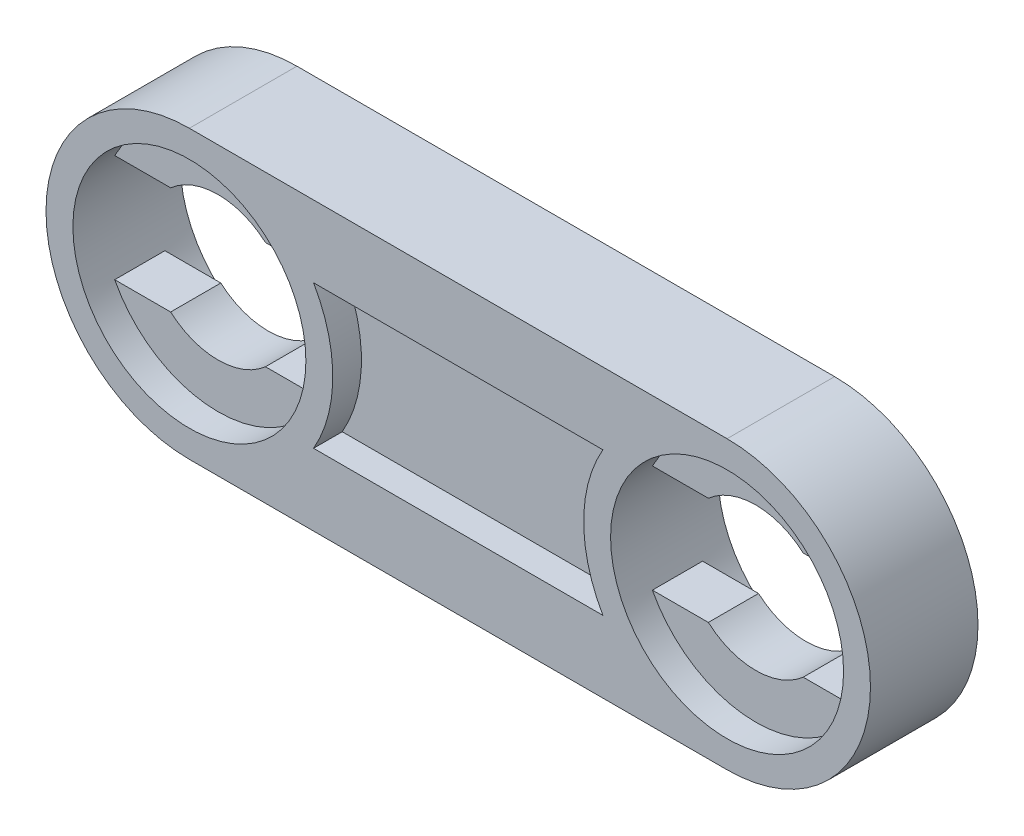
from build123d import *

# Parameters (mm, degrees)
EXTRUDE_1_DEPTH     = 3
CUT_EXTRUDE_1_REACH = 21.647
SKETCH_3_R          = 3.25
CUT_EXTRUDE_2_DEPTH = 0.8
CUT_EXTRUDE_START   = -2.2
SKETCH_3_2_R        = 3.25
CUT_EXTRUDE_3_DEPTH = 0.8
CUT_EXTRUDE_4_DEPTH = 0.8
SKETCH_5_W          = 7
SKETCH_5_H          = 4
CUT_EXTRUDE_5_DEPTH = 0.8


with BuildPart() as part:
    # 草图1 → 凸台-拉伸1 (new body)
    with BuildSketch(Plane.XY):
        with BuildLine():
            Line((0, 4), (15, 4))
            ThreePointArc((15, 4), (19, 0), (15, -4))
            Line((15, -4), (0, -4))
            ThreePointArc((0, -4), (-4, 0), (0, 4))
        make_face()
    extrude(amount=-EXTRUDE_1_DEPTH)

    # 草图2 → 切除-拉伸1 (cut, up to next)
    with BuildSketch(Plane.XY, mode=Mode.PRIVATE) as cut_extrude_1_sk1:
        with BuildLine():
            Line((1.322875656, -1.5), (2.883140649, -1.5))
            ThreePointArc((2.883140649, -1.5), (3.25, 0), (2.883140649, 1.5))
            Line((2.883140649, 1.5), (1.322875656, 1.5))
            ThreePointArc((1.322875656, 1.5), (0, 2), (-1.322875656, 1.5))
            Line((-1.322875656, 1.5), (-2.883140649, 1.5))
            ThreePointArc((-2.883140649, 1.5), (-3.25, 0), (-2.883140649, -1.5))
            Line((-2.883140649, -1.5), (-1.322875656, -1.5))
            ThreePointArc((-1.322875656, -1.5), (0, -2), (1.322875656, -1.5))
        make_face()
    cut_extrude_1_tool1 = extrude(cut_extrude_1_sk1.sketch, amount=-CUT_EXTRUDE_1_REACH, mode=Mode.PRIVATE) & part.part
    cut_extrude_1 = cut_extrude_1_tool1.solids().sort_by_distance((0, 0, 0))[0]
    add(cut_extrude_1, mode=Mode.SUBTRACT)

    # 草图3 → 切除-拉伸2 (cut)
    with BuildSketch(Plane.XY):
        Circle(SKETCH_3_R)
    cut_extrude_2 = extrude(amount=-CUT_EXTRUDE_2_DEPTH, mode=Mode.SUBTRACT)

    # 草图3<2> → 切除-拉伸3 (cut)
    with BuildSketch(Plane.XY.offset(CUT_EXTRUDE_START)):
        Circle(SKETCH_3_2_R)
    cut_extrude_3 = extrude(amount=-CUT_EXTRUDE_3_DEPTH, mode=Mode.SUBTRACT)

    # 镜向1: 切除-拉伸1, 切除-拉伸2, 切除-拉伸3 across plane
    add(cut_extrude_1.mirror(Plane(origin=(7.5, 0, 0), x_dir=(0, 0, 1), z_dir=(1, 0, 0))), mode=Mode.SUBTRACT)
    add(cut_extrude_2.mirror(Plane(origin=(7.5, 0, 0), x_dir=(0, 0, 1), z_dir=(1, 0, 0))), mode=Mode.SUBTRACT)
    add(cut_extrude_3.mirror(Plane(origin=(7.5, 0, 0), x_dir=(0, 0, 1), z_dir=(1, 0, 0))), mode=Mode.SUBTRACT)

    # 草图4 → 切除-拉伸4 (cut)
    with BuildSketch(Plane.XY):
        with BuildLine():
            Line((3.464101615, 2), (11.535898385, 2))
            ThreePointArc((11.535898385, 2), (11, 0), (11.535898385, -2))
            Line((11.535898385, -2), (3.464101615, -2))
            ThreePointArc((3.464101615, -2), (4, 0), (3.464101615, 2))
        make_face()
    extrude(amount=-CUT_EXTRUDE_4_DEPTH, mode=Mode.SUBTRACT)

    # 草图5 → 切除-拉伸5 (cut)
    with BuildSketch(Plane(origin=(0, 0, -3), x_dir=(-1, 0, 0), z_dir=(0, 0, -1))):
        with Locations((-7.5, 0)):
            Rectangle(SKETCH_5_W, SKETCH_5_H)
    extrude(amount=-CUT_EXTRUDE_5_DEPTH, mode=Mode.SUBTRACT)


solid = part.part
